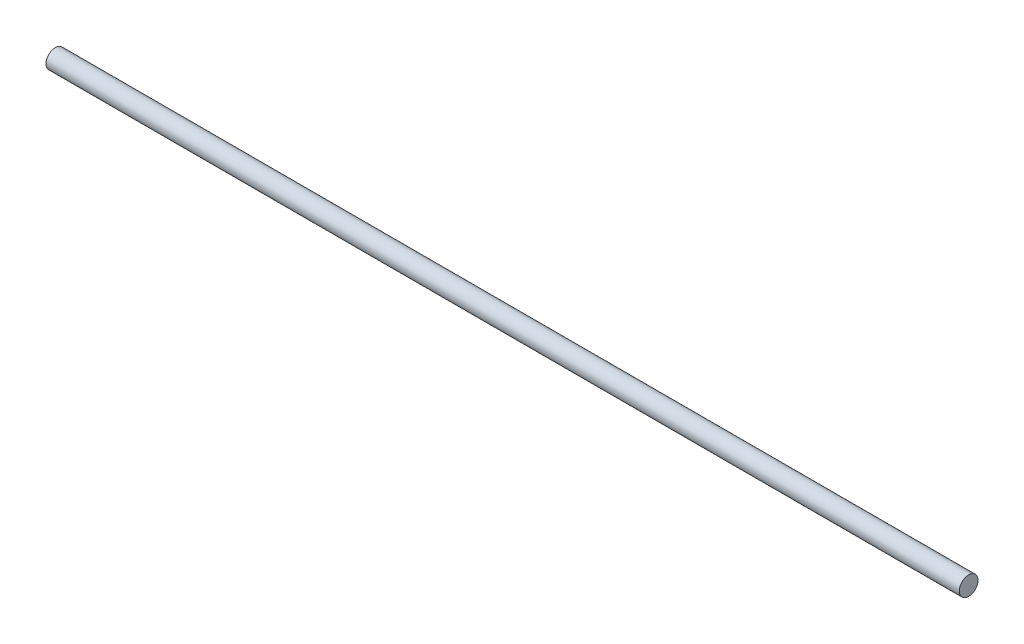
from build123d import *

# Parameters (mm, degrees)
SKETCH1_R           = 4
BOSS_EXTRUDE1_DEPTH = 390


with BuildPart() as part:
    # Sketch1 → Boss-Extrude1 (new body)
    with BuildSketch(Plane(origin=(0, 0, 0), x_dir=(0, 0, -1), z_dir=(1, 0, 0))):
        Circle(SKETCH1_R)
    extrude(amount=BOSS_EXTRUDE1_DEPTH)


solid = part.part
